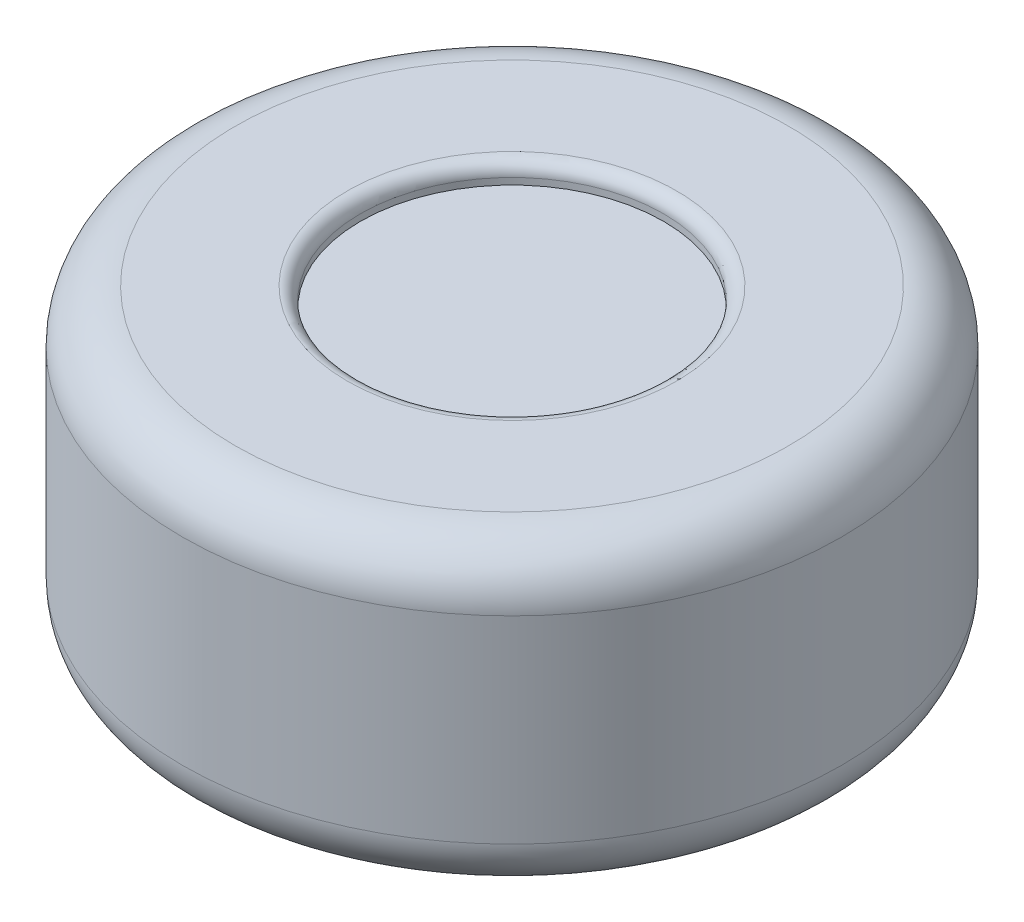
from build123d import *

# Parameters (mm, degrees)
SALIENTE_EXTRUIR1_DEPTH      = 100
SALIENTE_EXTRUIR1_DEPTH_BACK = 100
CROQUIS1_R                   = 120
SALIENTE_EXTRUIR4_DEPTH      = 115
SALIENTE_EXTRUIR4_DEPTH_BACK = 115
CROQUIS3_R                   = 250
CROQUIS3_R_2                 = 115
REDONDEO1_R                  = 40
REDONDEO2_R                  = 10
REDONDEO3_R                  = 10


with BuildPart() as part:
    # Croquis1 → Saliente-Extruir1 (new, two sides: drawn at the far end of the back side and taken through both)
    with BuildSketch(Plane(origin=(0, 0, 0), x_dir=(1, 0, 0), z_dir=(0, 1, 0)).offset(-SALIENTE_EXTRUIR1_DEPTH_BACK)):
        Circle(CROQUIS1_R)
    extrude(amount=SALIENTE_EXTRUIR1_DEPTH + SALIENTE_EXTRUIR1_DEPTH_BACK)

    # Croquis3 → Saliente-Extruir4 (add, two sides: drawn at the far end of the back side and taken through both)
    with BuildSketch(Plane(origin=(0, 0, 0), x_dir=(1, 0, 0), z_dir=(0, 1, 0)).offset(-SALIENTE_EXTRUIR4_DEPTH_BACK)):
        Circle(CROQUIS3_R)
        Circle(CROQUIS3_R_2, mode=Mode.SUBTRACT)
    extrude(amount=SALIENTE_EXTRUIR4_DEPTH + SALIENTE_EXTRUIR4_DEPTH_BACK)

    # Redondeo1
    redondeo1_edges = [part.edges().sort_by_distance(p)[0] for p in [
        (-250, 115, 0),
        (-250, -115, 0),
    ]]
    fillet(redondeo1_edges, radius=REDONDEO1_R)

    # Redondeo2
    redondeo2_edges = [part.edges().sort_by_distance(p)[0] for p in [
        (-115, -115, 0),
    ]]
    fillet(redondeo2_edges, radius=REDONDEO2_R)

    # Redondeo3
    redondeo3_edges = [part.edges().sort_by_distance(p)[0] for p in [
        (-115, 115, 0),
    ]]
    fillet(redondeo3_edges, radius=REDONDEO3_R)


solid = part.part
